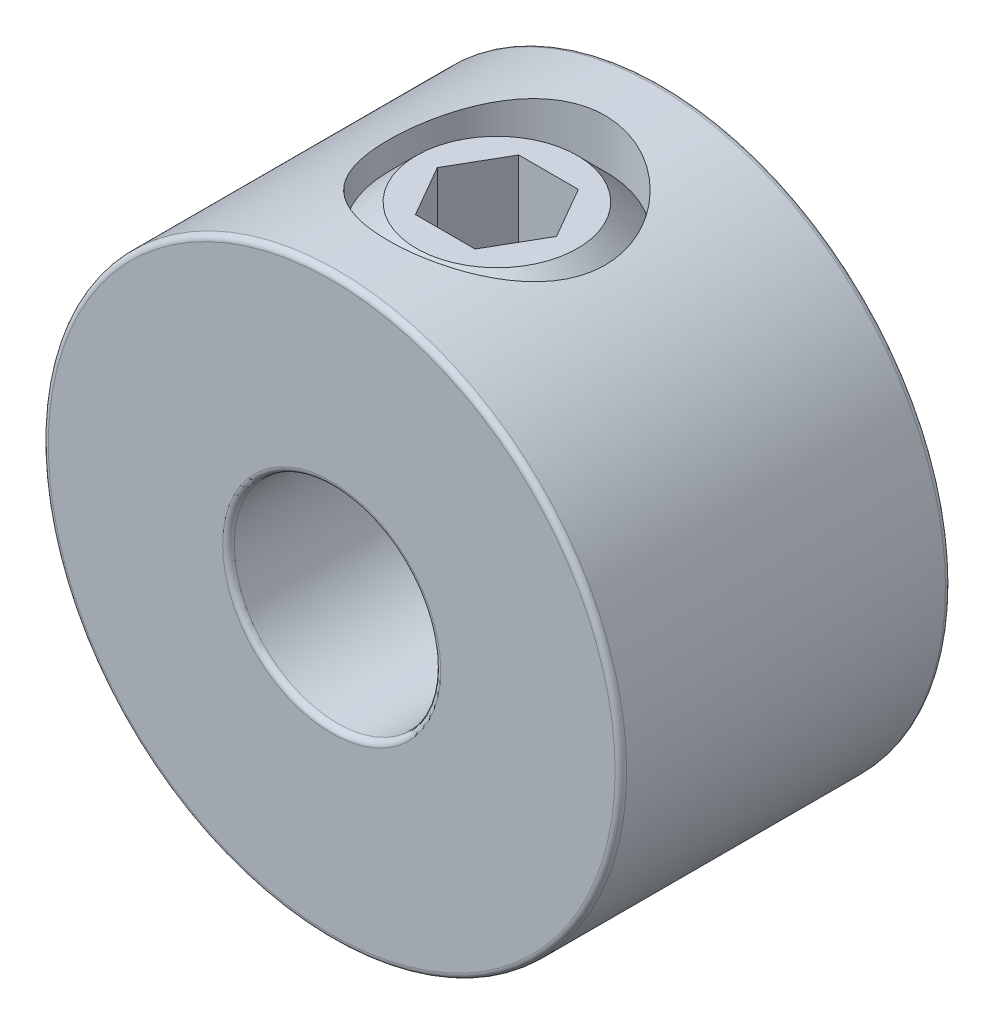
from build123d import *

# Parameters (mm, degrees)
SKETCH1_R          = 5.55625
SKETCH1_R_2        = 1.984375
EXTRUDE1_DEPTH     = 3.175
SKETCH2_R          = 2.0828
CUT_EXTRUDE1_DEPTH = 48.266462906
FILLET1_R          = 0.111125
CUT_EXTRUDE2_DEPTH = 1.984375


with BuildPart() as part:
    # Sketch1 → Extrude1 (new, symmetric)
    with BuildSketch(Plane.XY):
        Circle(SKETCH1_R)
        Circle(SKETCH1_R_2, mode=Mode.SUBTRACT)
    extrude(amount=EXTRUDE1_DEPTH, both=True)

    # Sketch2 → Cut-Extrude1 (cut, through all)
    with BuildSketch(Plane(origin=(41.275, 0, 0), x_dir=(0, 0, -1), z_dir=(0, -1, 0))):
        with Locations((0, -41.275)):
            Circle(SKETCH2_R)
    extrude(amount=-CUT_EXTRUDE1_DEPTH, mode=Mode.SUBTRACT)

    # Fillet1
    fillet1_edges = [part.edges().sort_by_distance(p)[0] for p in [
        (-5.55625, 0, -3.175),
        (-5.55625, 0, 3.175),
        (-1.984375, 0, -3.175),
        (-1.984375, 0, 3.175),
    ]]
    fillet(fillet1_edges, radius=FILLET1_R)


with BuildPart() as body_2:
    # Sketch3 → Revolve1 (revolve)
    with BuildSketch(Plane.XY):
        Polygon((-1.547302537, 1.984375), (-0.642596955, 1.984375), (0, 2.626971955), (0, 5.159375), (-1.547302537, 5.159375), (-2.0828, 4.623877537), (-2.0828, 2.519872463), align=None)
    revolve(axis=Axis((0, 1.984375, 0), (0, -1, 0)))

    # Sketch4 → Cut-Extrude2 (cut)
    with BuildSketch(Plane(origin=(3.3734375, 5.159375, 0), x_dir=(0, 0, -1), z_dir=(0, -1, 0))):
        Polygon((0, -2.22775806), (-0.9921875, -2.80059778), (-0.9921875, -3.94627722), (0, -4.51911694), (0.9921875, -3.94627722), (0.9921875, -2.80059778), align=None)
    extrude(amount=CUT_EXTRUDE2_DEPTH, mode=Mode.SUBTRACT)


solid = Compound([part.part, body_2.part])
